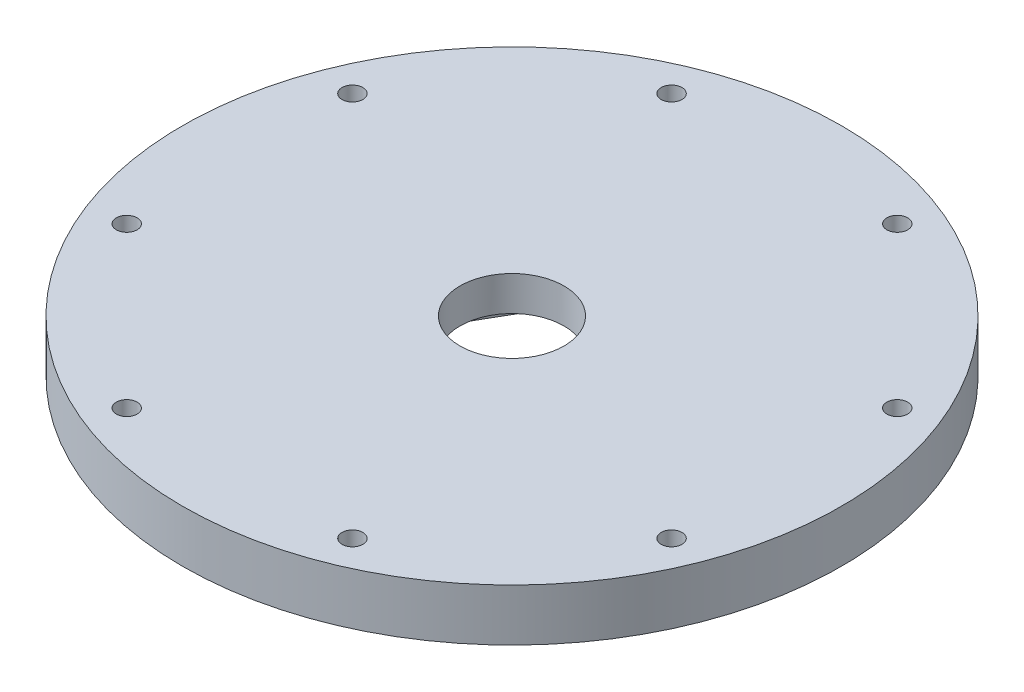
from build123d import *

# Parameters (mm, degrees)
IZIM1_R                     = 47.5
Y_KSEKLIK_EKSTR_ZYON1_DEPTH = 7.75
IZIM2_OUTSIDE_W             = 124.048
IZIM2_OUTSIDE_H             = 124.048
IZIM2_OUTSIDE_R             = 32.5
KES_EKSTR_ZYON1_DEPTH       = 8
KES_EKSTR_ZYON2_DEPTH       = 10.5
IZIM4_R                     = 30
KES_EKSTR_ZYON3_DEPTH       = 6
IZIM5_R                     = 1.5
KES_EKSTR_ZYON4_DEPTH       = 69.940191471
DAIRESEL_KAPLAMA1_COUNT     = 8
IZIM6_R                     = 7.5
KES_EKSTR_ZYON5_DEPTH       = 69.940191471


with BuildPart() as part:
    # Çizim1 → Yükseklik-Ekstrüzyon1 (new, symmetric)
    with BuildSketch(Plane(origin=(0, 0, 0), x_dir=(1, 0, 0), z_dir=(0, 1, 0))):
        with Locations(Location((0, 0, 0), (0, 0, 270))):
            Circle(IZIM1_R)
    extrude(amount=Y_KSEKLIK_EKSTR_ZYON1_DEPTH, both=True)

    # Çizim2 outside → Kes-Ekstrüzyon1 (cut)
    with BuildSketch(Plane.XZ.offset(7.75)):
        Rectangle(IZIM2_OUTSIDE_W, IZIM2_OUTSIDE_H)
        with Locations(Location((0, 0, 0), (0, 0, 270))):
            Circle(IZIM2_OUTSIDE_R, mode=Mode.SUBTRACT)
    extrude(amount=-KES_EKSTR_ZYON1_DEPTH, mode=Mode.SUBTRACT)

    # Çizim3 → Kes-Ekstrüzyon2 (cut)
    with BuildSketch(Plane.XZ.offset(7.75)):
        Polygon((15.25, 0), (7.625, 13.206887408), (-7.625, 13.206887408), (-15.25, 0), (-7.625, -13.206887408), (7.625, -13.206887408), align=None)
    extrude(amount=-KES_EKSTR_ZYON2_DEPTH, mode=Mode.SUBTRACT)

    # Çizim4 → Kes-Ekstrüzyon3 (cut)
    with BuildSketch(Plane.XZ.offset(7.75)):
        with Locations(Location((0, 0, 0), (0, 0, 270))):
            Circle(IZIM4_R)
    extrude(amount=-KES_EKSTR_ZYON3_DEPTH, mode=Mode.SUBTRACT)

    # Çizim5 → Kes-Ekstrüzyon4 (cut, through all)
    with BuildSketch(Plane(origin=(0, 7.75, 0), x_dir=(1, 0, 0), z_dir=(0, 1, 0))):
        with Locations(Location((-16.264045876, 39.264880132, 0), (0, 0, 270))):
            Circle(IZIM5_R)
    kes_ekstr_zyon4 = extrude(amount=-KES_EKSTR_ZYON4_DEPTH, mode=Mode.SUBTRACT)

    # Dairesel Kaplama1: Kes-Ekstrüzyon4 ×8 about axis
    dairesel_kaplama1_axis = Axis((0, 0, 0), (0, 1, 0))
    for i in range(1, DAIRESEL_KAPLAMA1_COUNT):
        add(kes_ekstr_zyon4.rotate(dairesel_kaplama1_axis, i * 360 / DAIRESEL_KAPLAMA1_COUNT), mode=Mode.SUBTRACT)

    # Çizim6 → Kes-Ekstrüzyon5 (cut, through all)
    with BuildSketch(Plane(origin=(0, 7.75, 0), x_dir=(1, 0, 0), z_dir=(0, 1, 0))):
        with Locations(Location((0, 0, 0), (0, 0, 270))):
            Circle(IZIM6_R)
    extrude(amount=-KES_EKSTR_ZYON5_DEPTH, mode=Mode.SUBTRACT)


solid = part.part
